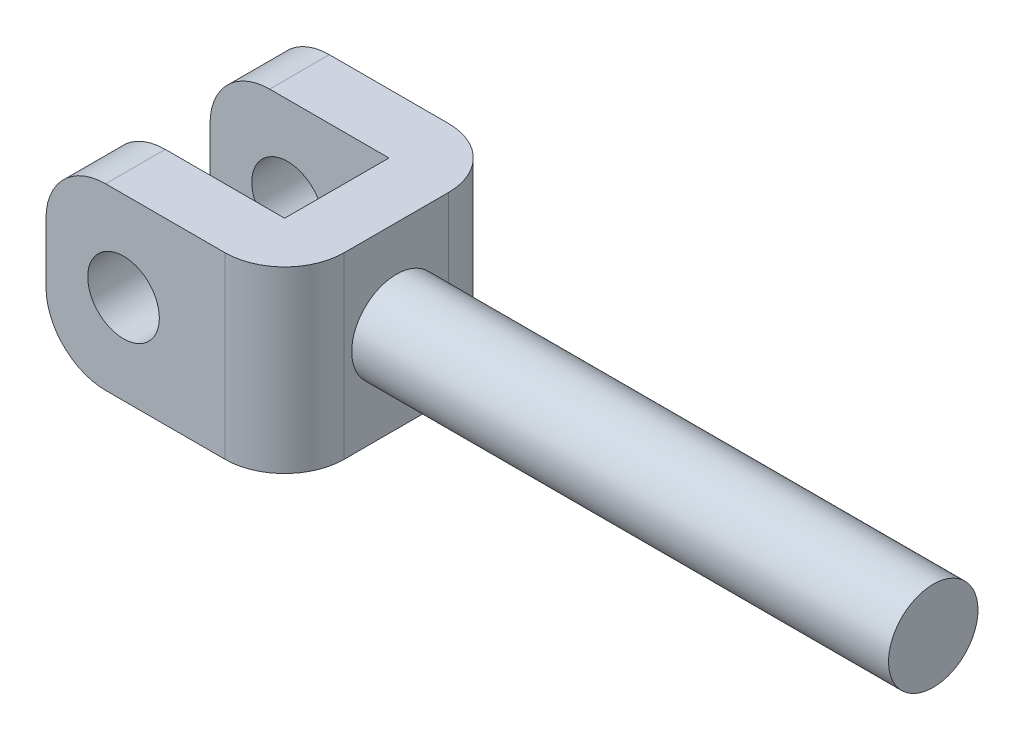
from build123d import *

# Parameters (mm, degrees)
SKETCH1_R                = 0.75
BOSS_EXTRUDE1_DEPTH      = 10
BOSS_EXTRUDE2_DEPTH      = 1.5
BOSS_EXTRUDE2_DEPTH_BACK = 1.5
FILLET1_R                = 1
SKETCH3_R                = 0.6
CUT_EXTRUDE1_DEPTH       = 5


with BuildPart() as part:
    # Sketch1 → Boss-Extrude1 (new body)
    with BuildSketch(Plane(origin=(0, 0, 0), x_dir=(0, 0, -1), z_dir=(1, 0, 0))):
        Circle(SKETCH1_R)
    extrude(amount=BOSS_EXTRUDE1_DEPTH)

    # Sketch2 → Boss-Extrude2 (add, two sides: drawn at the far end of the back side and taken through both)
    with BuildSketch(Plane(origin=(0, 0, 0), x_dir=(1, 0, 0), z_dir=(0, 1, 0)).offset(-BOSS_EXTRUDE2_DEPTH_BACK)):
        Polygon((1, 1.875), (1, -1.875), (-3, -1.875), (-3, -0.875), (0, -0.875), (0, 0.875), (-3, 0.875), (-3, 1.875), align=None)
    extrude(amount=BOSS_EXTRUDE2_DEPTH + BOSS_EXTRUDE2_DEPTH_BACK)

    # Fillet1
    fillet1_edges = [part.edges().sort_by_distance(p)[0] for p in [
        (-3, 1.5, -1.375),
        (-3, -1.5, -1.375),
        (-3, -1.5, 1.375),
        (-3, 1.5, 1.375),
        (1, 0, -1.875),
        (1, 0, 1.875),
    ]]
    fillet(fillet1_edges, radius=FILLET1_R)

    # Sketch3 → Cut-Extrude1 (cut)
    with BuildSketch(Plane(origin=(0, 0, -1.875), x_dir=(-1, 0, 0), z_dir=(0, 0, -1))):
        with Locations((1.7, 0)):
            Circle(SKETCH3_R)
    extrude(amount=-CUT_EXTRUDE1_DEPTH, mode=Mode.SUBTRACT)


solid = part.part
